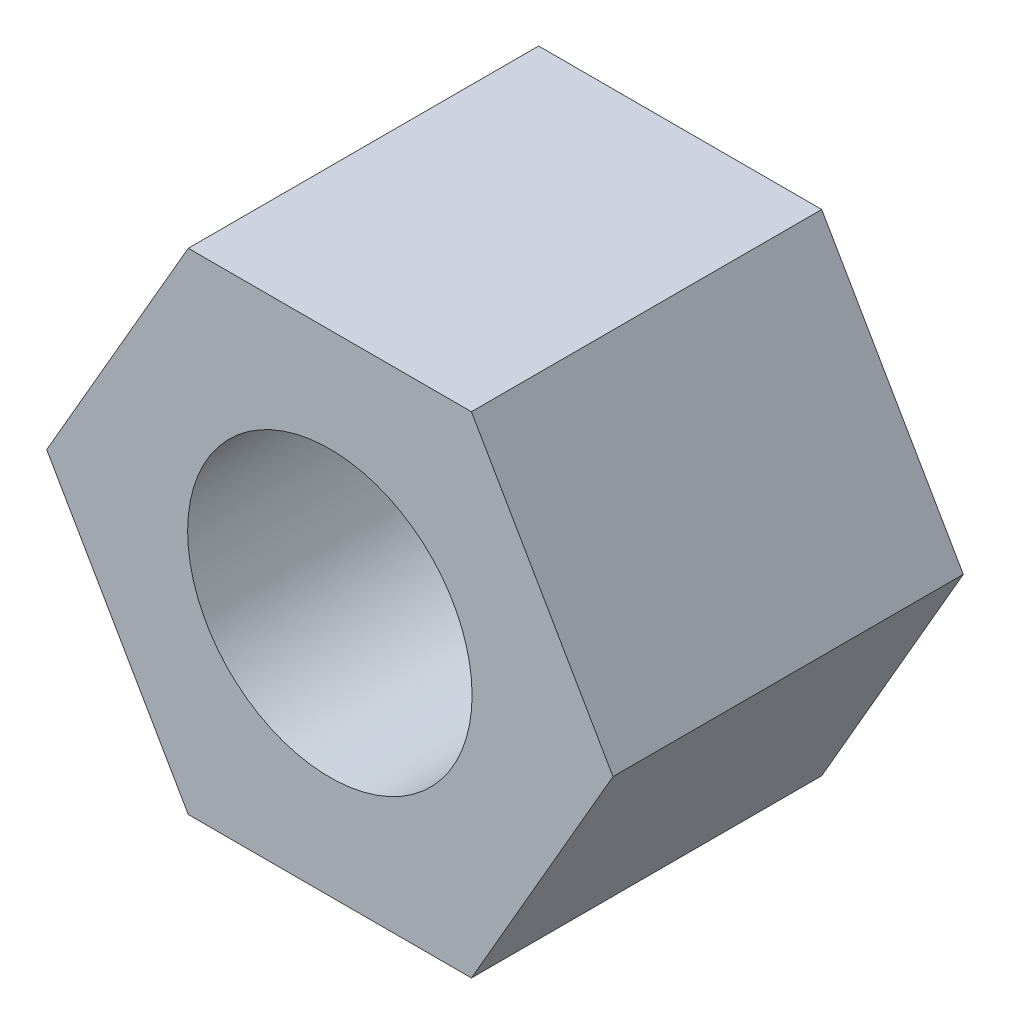
from build123d import *

# Parameters (mm, degrees)
S01_HEXAGON_AND_NOMINAL_THREAD_ENVELOP_R       = 2.03
F_01_HEXAGON_AND_NOMINAL_THREAD_ENVELOPE_DEPTH = 5


with BuildPart() as part:
    # S01 - Hexagon and nominal thread envelope → 01 - Hexagon and nominal thread envelope (new body)
    with BuildSketch(Plane.XY):
        Polygon((4.041451884, 0), (2.020725942, 3.5), (-2.020725942, 3.5), (-4.041451884, 0), (-2.020725942, -3.5), (2.020725942, -3.5), align=None)
        Circle(S01_HEXAGON_AND_NOMINAL_THREAD_ENVELOP_R, mode=Mode.SUBTRACT)
    extrude(amount=F_01_HEXAGON_AND_NOMINAL_THREAD_ENVELOPE_DEPTH)


solid = part.part
